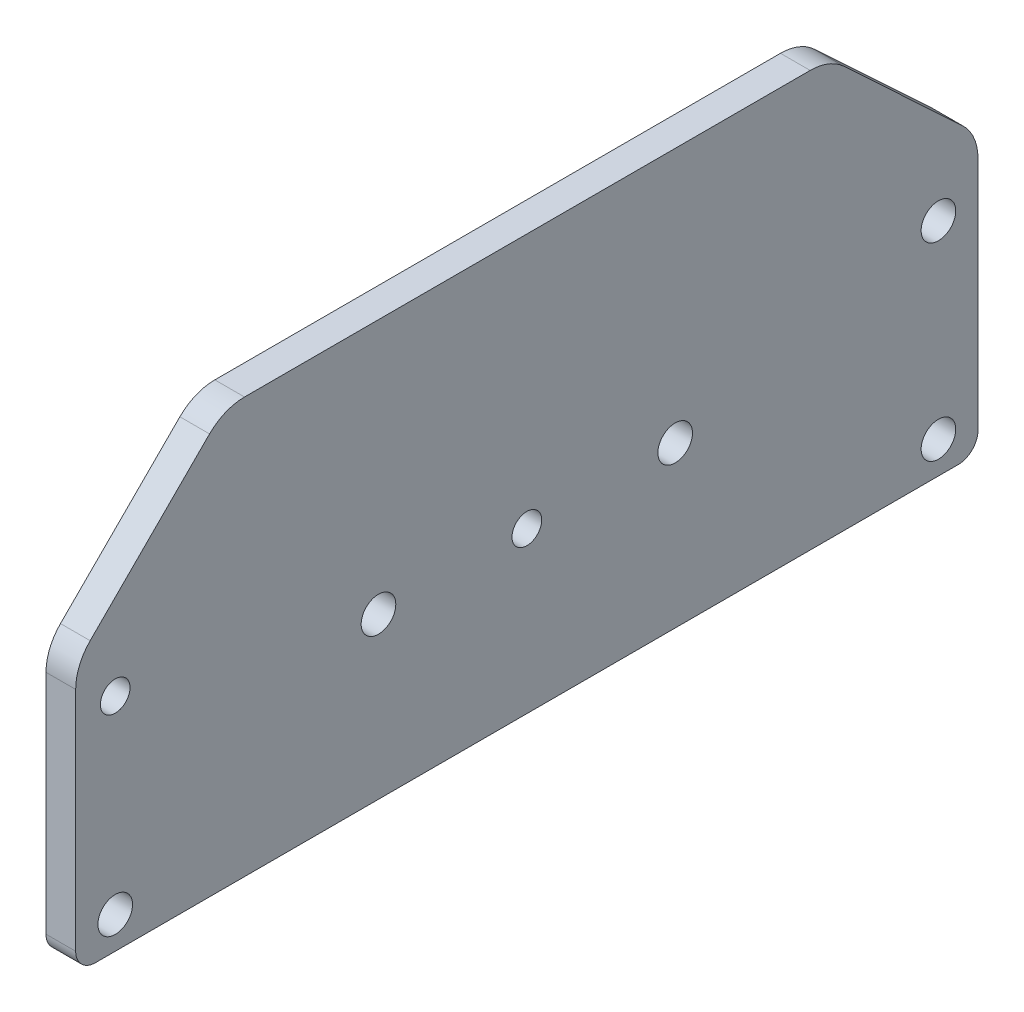
from build123d import *

# Parameters (mm, degrees)
SKETCH1_R           = 17.5
SKETCH1_R_2         = 15
BOSS_EXTRUDE1_DEPTH = 30


with BuildPart() as part:
    # Sketch1 → Boss-Extrude1 (new body)
    with BuildSketch(Plane(origin=(0, 0, 0), x_dir=(0, 0, -1), z_dir=(1, 0, 0))):
        with BuildLine():
            Line((0, 249.289321881), (0, 20))
            ThreePointArc((0, 20), (5.857864376, 5.857864376), (20, 0))
            Line((20, 0), (456.16, 0))
            Line((456.16, 0), (892.32, 0))
            ThreePointArc((892.32, 0), (906.462135624, 5.857864376), (912.32, 20))
            Line((912.32, 20), (912.32, 258.272384904))
            ThreePointArc((912.32, 258.272384904), (908.177363781, 278.199807895), (896.435912518, 294.825148317))
            Line((896.435912518, 294.825148317), (776.727753487, 406.552763412))
            ThreePointArc((776.727753487, 406.552763412), (760.947077938, 416.516868825), (742.611840969, 420))
            Line((742.611840969, 420), (170.710678119, 420))
            ThreePointArc((170.710678119, 420), (151.5765065, 416.193976626), (135.355339059, 405.355339059))
            Line((135.355339059, 405.355339059), (14.644660941, 284.644660941))
            ThreePointArc((14.644660941, 284.644660941), (3.806023374, 268.4234935), (0, 249.289321881))
        make_face()
        with Locations((40, 32.245311268)):
            Circle(SKETCH1_R, mode=Mode.SUBTRACT)
        with Locations((872.32, 223.507722896)):
            Circle(SKETCH1_R, mode=Mode.SUBTRACT)
        with Locations((872.32, 32.245311268)):
            Circle(SKETCH1_R, mode=Mode.SUBTRACT)
        with Locations((606.16, 162.057722896)):
            Circle(SKETCH1_R, mode=Mode.SUBTRACT)
        with Locations((306.16, 162.057722896)):
            Circle(SKETCH1_R, mode=Mode.SUBTRACT)
        with BuildLine():
            ThreePointArc((456.16, 177.057722896), (471.16, 162.057722896), (456.16, 147.057722896))
            ThreePointArc((456.16, 147.057722896), (441.16, 162.057722896), (456.16, 177.057722896))
        make_face(mode=Mode.SUBTRACT)
        with Locations((40, 223.507722896)):
            Circle(SKETCH1_R_2, mode=Mode.SUBTRACT)
    extrude(amount=BOSS_EXTRUDE1_DEPTH)


solid = part.part
